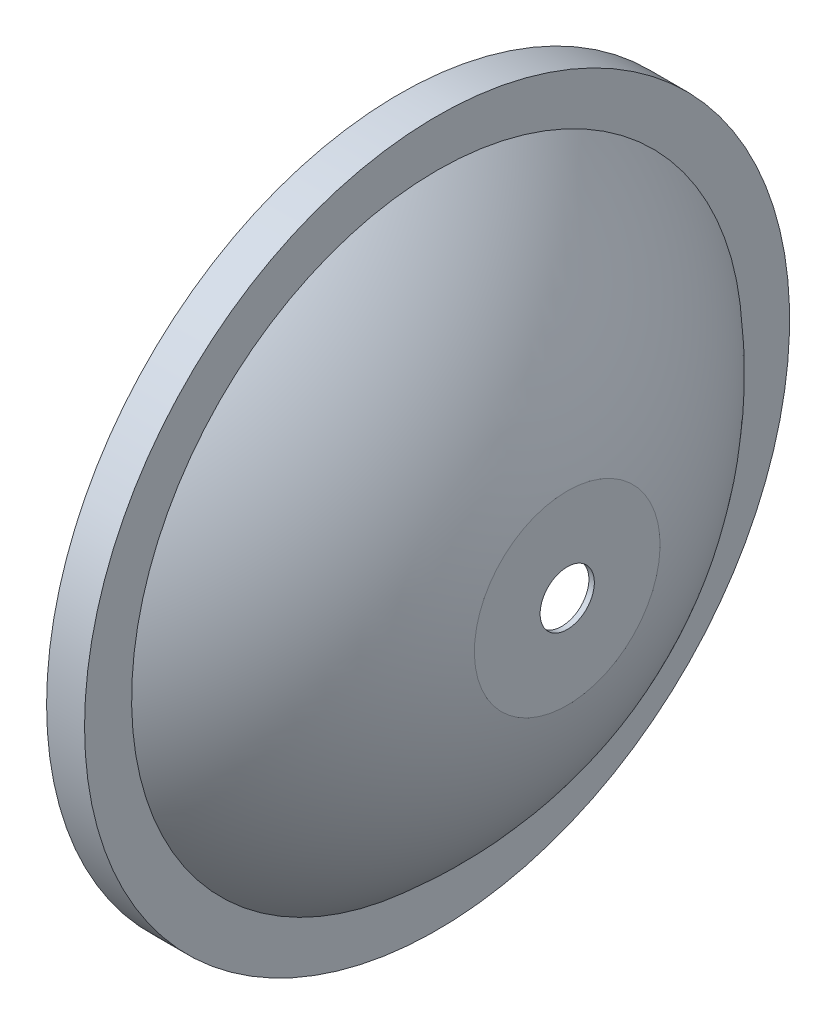
from build123d import *


with BuildPart() as part:
    # Sketch1 → Revolve2 (revolve)
    with BuildSketch(Plane.XY, mode=Mode.PRIVATE) as revolve2_sk:
        with BuildLine():
            Line((-29.992957397, 64), (-23.992957397, 64))
            Line((-23.992957397, 64), (-23.992957397, 55.856960175))
            ThreePointArc((-23.992957397, 55.856960175), (-8.879751576, 38.352961589), (0, 17))
            Line((0, 17), (0, 5))
            Line((0, 5), (1, 5))
            Line((1, 5), (1, 17.117654197))
            ThreePointArc((1, 17.117654197), (-7.875658194, 38.629089315), (-22.992957397, 56.320511361))
            Line((-22.992957397, 56.320511361), (-22.992957397, 65))
            Line((-22.992957397, 65), (-29.992957397, 65))
            Line((-29.992957397, 65), (-29.992957397, 64))
        make_face()
    revolve(revolve2_sk.sketch.rotate(Axis((-81.84974801, 0, 0), (1, 0, 0)), 90), axis=Axis((-81.84974801, 0, 0), (1, 0, 0)))


solid = part.part
